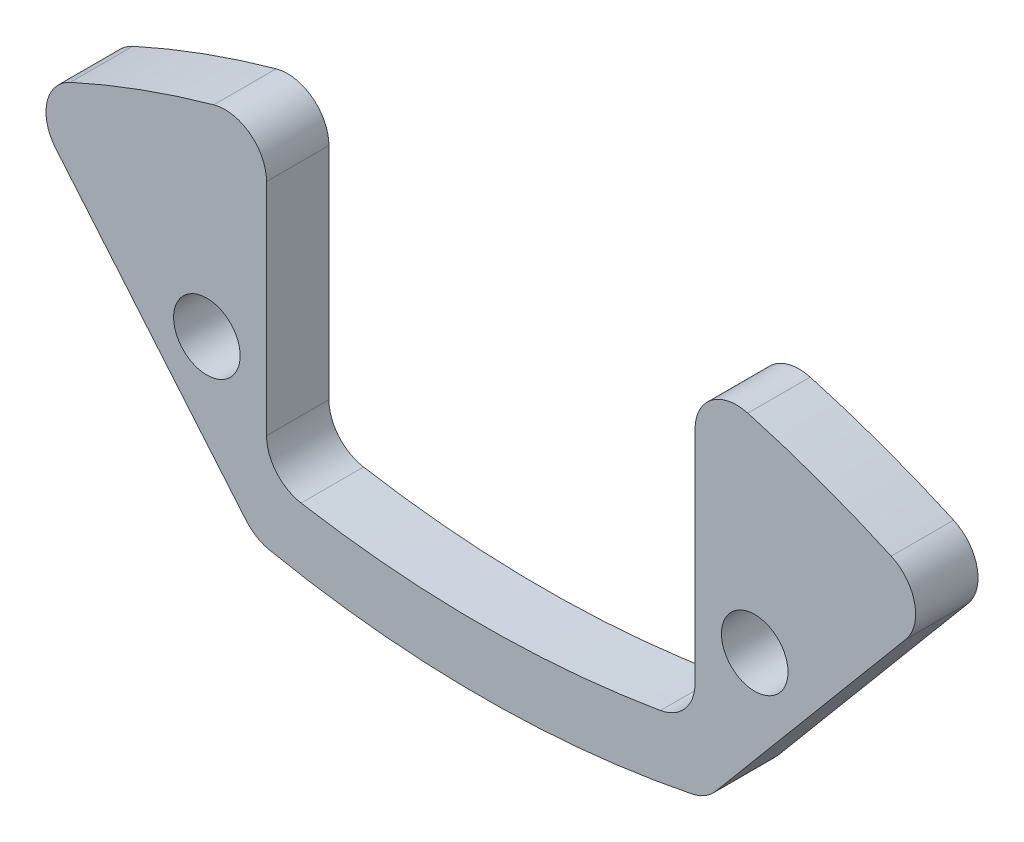
from build123d import *

# Parameters (mm, degrees)
SKETCH_1_R          = 47.75
EXTRUDE_1_DEPTH     = 3
SKETCH_2_R          = 1.6
CUT_EXTRUDE_1_DEPTH = 68.595303091
FILLET_1_R          = 2


with BuildPart() as part:
    # ｽｹｯﾁ1 → ﾎﾞｽ - 押し出し1 (new body)
    with BuildSketch(Plane.XY):
        Circle(SKETCH_1_R)
    extrude(amount=EXTRUDE_1_DEPTH)

    # ｽｹｯﾁ2 → ｶｯﾄ - 押し出し1 (cut, through all)
    with BuildSketch(Plane.XY.offset(3)):
        with Locations((-13.167775518, 36.1781659)):
            Circle(SKETCH_2_R)
        with Locations((13.167775518, 36.1781659)):
            Circle(SKETCH_2_R)
        with BuildLine():
            Line((-10.3, 46.625878008), (-10.3, 31.825692416))
            ThreePointArc((-10.3, 31.825692416), (0, 30.78), (10.3, 31.825692416))
            Line((10.3, 31.825692416), (10.3, 46.625878008))
            ThreePointArc((10.3, 46.625878008), (0, 47.75), (-10.3, 46.625878008))
        make_face()
        with BuildLine():
            Line((-22.08027891, 42.338207133), (-10.836871488, 28.938835945))
            ThreePointArc((-10.836871488, 28.938835945), (0, 27.78), (10.836871488, 28.938835945))
            Line((10.836871488, 28.938835945), (22.08027891, 42.338207133))
            ThreePointArc((22.08027891, 42.338207133), (0, -47.75), (-22.08027891, 42.338207133))
        make_face()
    extrude(amount=-CUT_EXTRUDE_1_DEPTH, mode=Mode.SUBTRACT)

    # ﾌｨﾚｯﾄ1
    fillet_1_edges = [part.edges().sort_by_distance(p)[0] for p in [
        (22.08027891, 42.338207133, 1.5),
        (-22.08027891, 42.338207133, 1.5),
        (-10.836871488, 28.938835945, 1.5),
        (10.836871488, 28.938835945, 1.5),
        (-10.3, 46.625878008, 1.5),
        (10.3, 46.625878008, 1.5),
        (10.3, 31.825692416, 1.5),
        (-10.3, 31.825692416, 1.5),
    ]]
    fillet(fillet_1_edges, radius=FILLET_1_R)


solid = part.part
